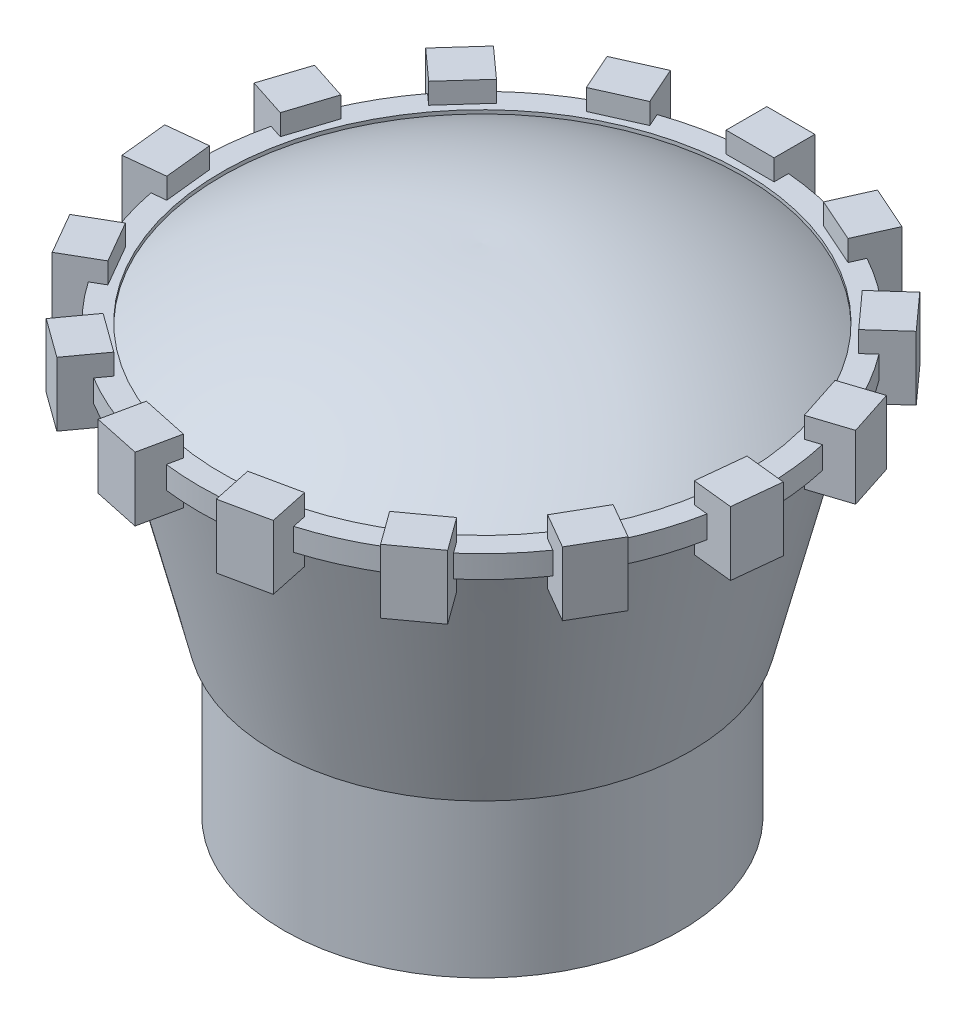
from build123d import *

# Parameters (mm, degrees)
SKETCH1_R           = 6.5
BOSS_EXTRUDE1_DEPTH = 8
BOSS_EXTRUDE1_DRAFT = -14
SKETCH2_R           = 6.2
BOSS_EXTRUDE2_DEPTH = 5
SKETCH3_R           = 5.75
CUT_EXTRUDE1_DEPTH  = 5
SKETCH5_W           = 0.7
SKETCH5_H           = 0.7
SKETCH6_W           = 1.273218484
SKETCH6_H           = 2
BOSS_EXTRUDE4_DEPTH = 0.75
CIRPATTERN1_COUNT   = 15


with BuildPart() as part:
    # Sketch1 → Boss-Extrude1 (with draft: the straight prism first)
    with BuildSketch(Plane(origin=(0, 0, 0), x_dir=(1, 0, 0), z_dir=(0, 1, 0))):
        Circle(SKETCH1_R)
    extrude(amount=BOSS_EXTRUDE1_DEPTH)
    # Boss-Extrude1: the draft: its side faces are tilted about the plane it starts from
    boss_extrude1_sides = [part.faces().sort_by_distance(p)[0] for p in [
        (-6.5, 4, 0),
    ]]
    draft(boss_extrude1_sides, Plane(origin=(0, 0, 0), x_dir=(1, 0, 0), z_dir=(0, 1, 0)), BOSS_EXTRUDE1_DRAFT)

    # Sketch2 → Boss-Extrude2 (add)
    with BuildSketch(Plane.XZ):
        with Locations(Location((0, 0, 0), (0, 0, 270))):
            Circle(SKETCH2_R)
    extrude(amount=BOSS_EXTRUDE2_DEPTH)

    # Sketch3 → Cut-Extrude1 (cut)
    with BuildSketch(Plane.XZ.offset(5)):
        with Locations(Location((0, 0, 0), (0, 0, 270))):
            Circle(SKETCH3_R)
    extrude(amount=-CUT_EXTRUDE1_DEPTH, mode=Mode.SUBTRACT)

    # Sketch4 → Revolve1 (revolve)
    with BuildSketch(Plane(origin=(0, 0, 0), x_dir=(0, 0, -1), z_dir=(1, 0, 0)), mode=Mode.PRIVATE) as revolve1_sk:
        with BuildLine():
            Line((0, 8), (0, 10.5))
            add(Edge.make_bspline(
                [(0, 10.5), (4.616560174, 10.68965763), (8.494624023, 8)],
                knots=[0, 0, 0, 1, 1, 1], degree=2))
            Line((8.494624023, 8), (0, 8))
        make_face()
    revolve(revolve1_sk.sketch.rotate(Axis((0, 8, 0), (0, 1, 0)), 180), axis=Axis((0, 8, 0), (0, 1, 0)))

    # Sketch5 → Revolve2 (revolve)
    with BuildSketch(Plane(origin=(0, 0, 0), x_dir=(0, 0, -1), z_dir=(1, 0, 0))):
        with Locations((8.494624023, 8)):
            Rectangle(SKETCH5_W, SKETCH5_H)
    revolve(axis=Axis((0, -5.748475936, 0), (0, 1, 0)))

    # Sketch6 → Boss-Extrude4 (add, symmetric)
    with BuildSketch(Plane(origin=(0, 0, 0), x_dir=(0, 0, -1), z_dir=(1, 0, 0))):
        with Locations((9, 8)):
            Rectangle(SKETCH6_W, SKETCH6_H)
    boss_extrude4 = extrude(amount=BOSS_EXTRUDE4_DEPTH, both=True)

    # CirPattern1: Boss-Extrude4 ×15 about axis
    cirpattern1_axis = Axis((0, 0, 0), (0, 1, 0))
    for i in range(1, CIRPATTERN1_COUNT):
        add(boss_extrude4.rotate(cirpattern1_axis, i * 360 / CIRPATTERN1_COUNT))


solid = part.part
